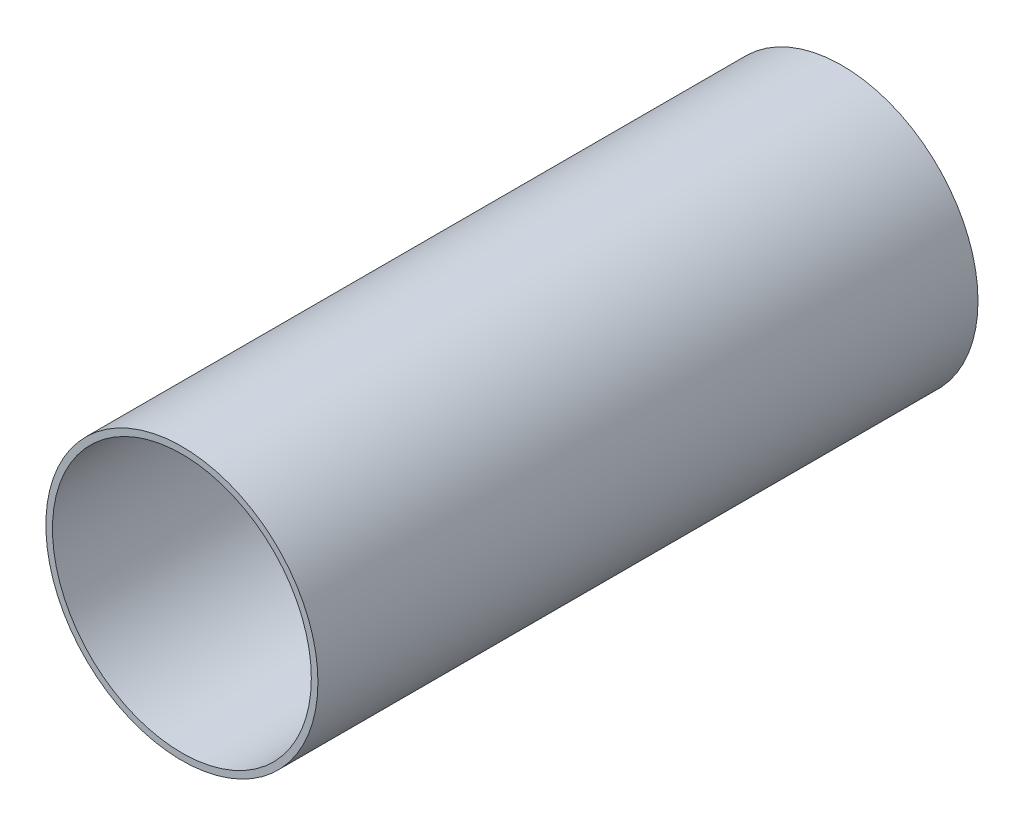
from build123d import *

# Parameters (mm, degrees)
SKETCH18_R          = 16.9
BOSS_EXTRUDE6_DEPTH = 82
SKETCH19_R          = 16.08
CUT_EXTRUDE2_DEPTH  = 86.412060038


with BuildPart() as part:
    # Sketch18 → Boss-Extrude6 (new body)
    with BuildSketch(Plane.XY):
        Circle(SKETCH18_R)
    extrude(amount=BOSS_EXTRUDE6_DEPTH)

    # Sketch19 → Cut-Extrude2 (cut, through all)
    with BuildSketch(Plane.XY.offset(82)):
        Circle(SKETCH19_R)
    extrude(amount=-CUT_EXTRUDE2_DEPTH, mode=Mode.SUBTRACT)


solid = part.part
